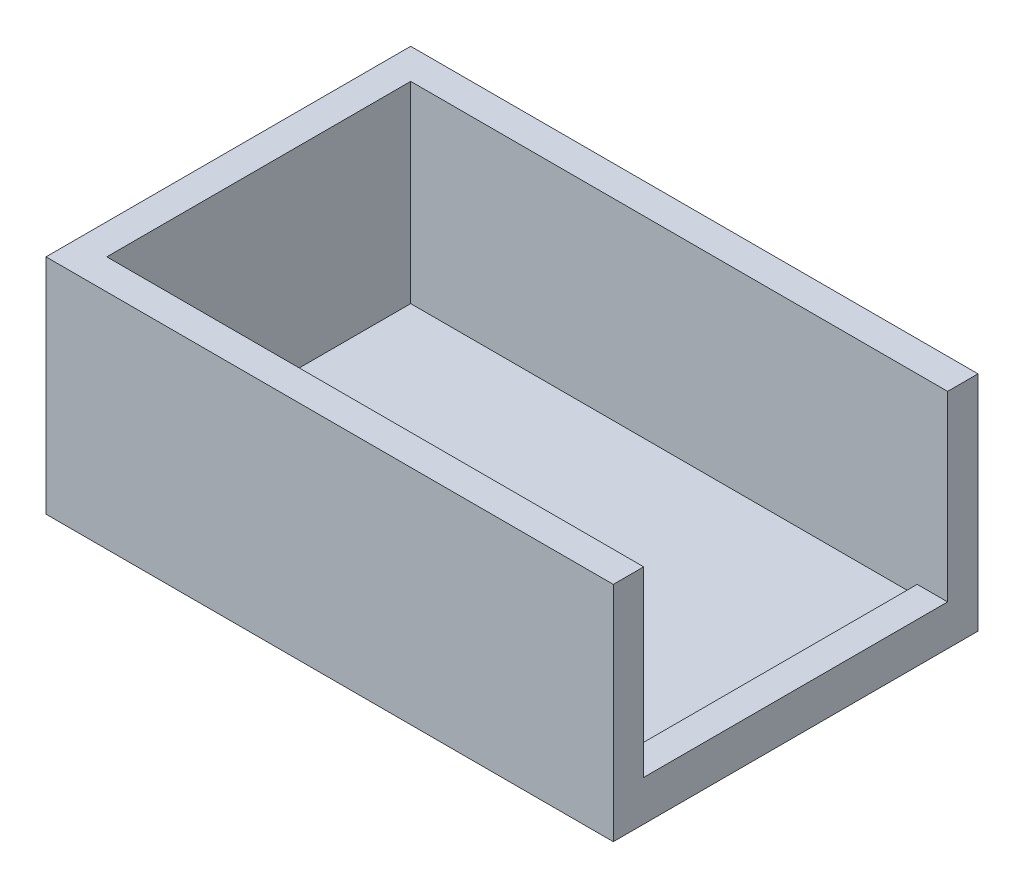
from build123d import *

# Parameters (mm, degrees)
SKETCH1_W           = 56
SKETCH1_H           = 36
BOSS_EXTRUDE1_DEPTH = 22
SKETCH3_W           = 50
SKETCH3_H           = 30
CUT_EXTRUDE1_DEPTH  = 19
SKETCH4_W           = 3
SKETCH4_H           = 30
CUT_EXTRUDE2_DEPTH  = 18


with BuildPart() as part:
    # Sketch1 → Boss-Extrude1 (new body)
    with BuildSketch(Plane(origin=(0, 0, 0), x_dir=(1, 0, 0), z_dir=(0, 1, 0))):
        Rectangle(SKETCH1_W, SKETCH1_H)
    extrude(amount=BOSS_EXTRUDE1_DEPTH)

    # Sketch3 → Cut-Extrude1 (cut)
    with BuildSketch(Plane(origin=(0, 22, 0), x_dir=(1, 0, 0), z_dir=(0, 1, 0))):
        Rectangle(SKETCH3_W, SKETCH3_H)
    extrude(amount=-CUT_EXTRUDE1_DEPTH, mode=Mode.SUBTRACT)

    # Sketch4 → Cut-Extrude2 (cut)
    with BuildSketch(Plane(origin=(0, 22, 0), x_dir=(1, 0, 0), z_dir=(0, 1, 0))):
        with Locations((26.5, 0)):
            Rectangle(SKETCH4_W, SKETCH4_H)
    extrude(amount=-CUT_EXTRUDE2_DEPTH, mode=Mode.SUBTRACT)


solid = part.part
